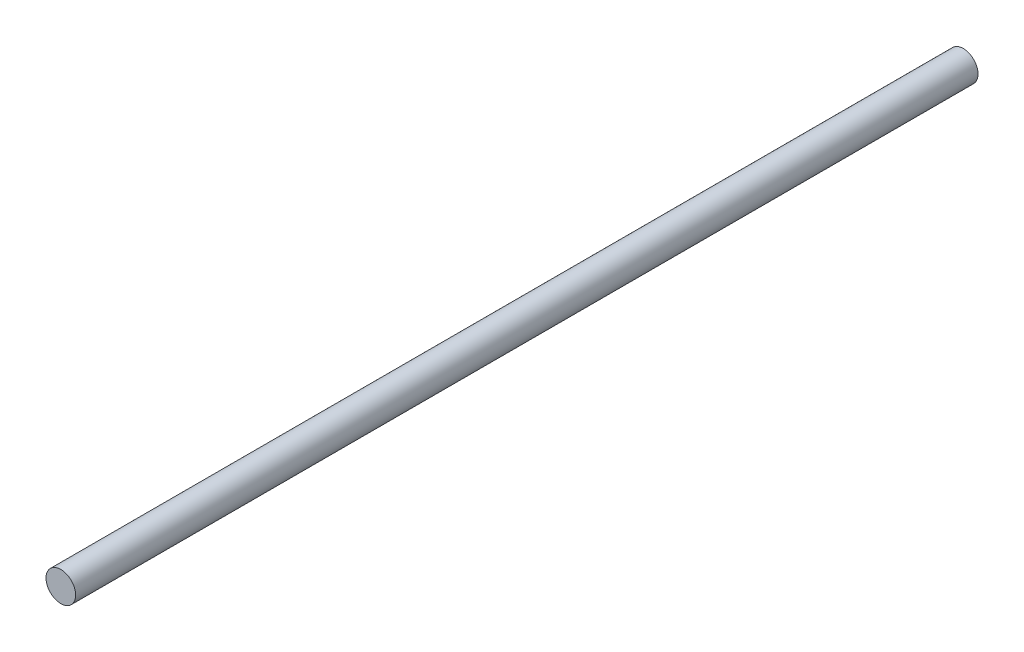
from build123d import *

# Parameters (mm, degrees)
SKETCH1_R           = 1.5
BOSS_EXTRUDE1_DEPTH = 91.4


with BuildPart() as part:
    # Sketch1 → Boss-Extrude1 (new body)
    with BuildSketch(Plane.XY):
        with Locations(Location((0, 0, 0), (0, 0, 180))):
            Circle(SKETCH1_R)
    extrude(amount=BOSS_EXTRUDE1_DEPTH)


solid = part.part
